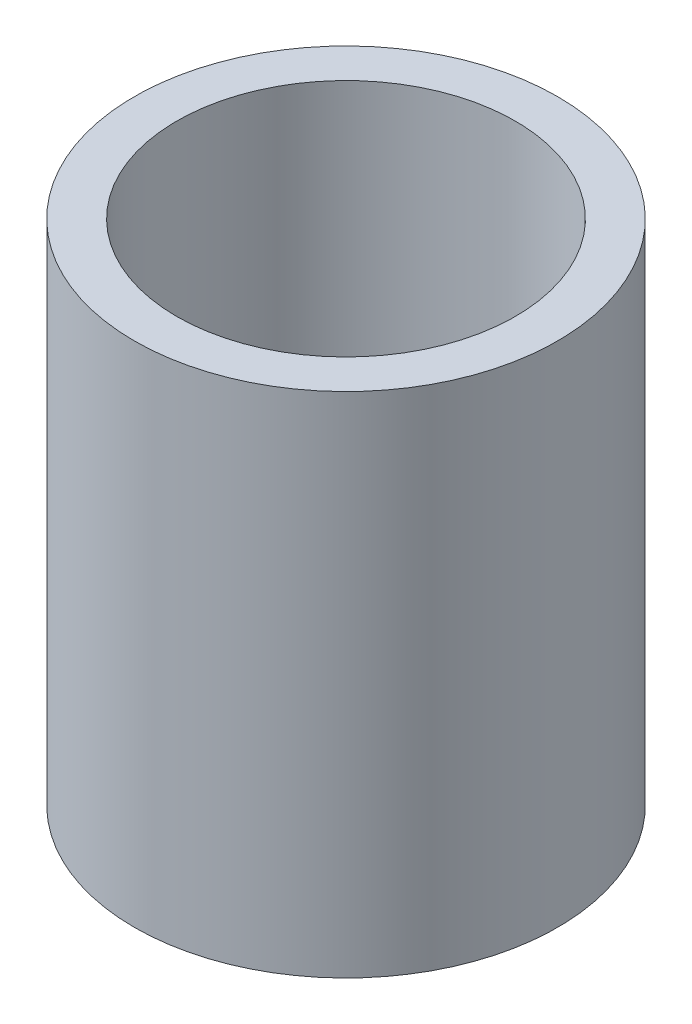
from build123d import *

# Parameters (mm, degrees)
ESQUISSE1_R             = 25
BOSS_EXTRU_1_DEPTH      = 60
ESQUISSE2_R             = 20
ENL_V_MAT_EXTRU_1_DEPTH = 55


with BuildPart() as part:
    # Esquisse1 → Boss.-Extru.1 (new body)
    with BuildSketch(Plane(origin=(0, 0, 0), x_dir=(1, 0, 0), z_dir=(0, 1, 0))):
        with Locations(Location((0, 0, 0), (0, 0, 270))):
            Circle(ESQUISSE1_R)
    extrude(amount=BOSS_EXTRU_1_DEPTH)

    # Esquisse2 → Enlèv. mat.-Extru.1 (cut)
    with BuildSketch(Plane(origin=(0, 60, 0), x_dir=(1, 0, 0), z_dir=(0, 1, 0))):
        with Locations(Location((0, 0, 0), (0, 0, 270))):
            Circle(ESQUISSE2_R)
    extrude(amount=-ENL_V_MAT_EXTRU_1_DEPTH, mode=Mode.SUBTRACT)


solid = part.part
